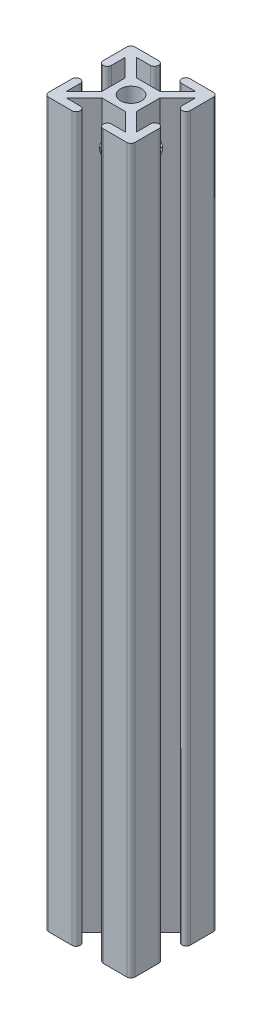
from build123d import *

# Parameters (mm, degrees)
CROQUIS1_R              = 3.645
SALIENTE_EXTRUIR1_DEPTH = 200
CROQUIS1_2_R            = 3.645
SALIENTE_EXTRUIR2_DEPTH = 250
SKETCH1_R               = 6.5
CUT_EXTRUDE1_DEPTH      = 12
SKETCH2_R               = 6.494213274
CUT_EXTRUDE2_DEPTH      = 12
SKETCH3_R               = 4
CUT_EXTRUDE3_DEPTH      = 12
SKETCH4_R               = 4
CUT_EXTRUDE4_DEPTH      = 12


with BuildPart() as part:
    # Croquis1 → Saliente-Extruir1 (new body)
    with BuildSketch(Plane(origin=(0, 0, 0), x_dir=(1, 0, 0), z_dir=(0, 1, 0))):
        with BuildLine():
            Line((32.848419758, -5.213604898), (37.573419758, -5.213604898))
            Line((37.573419758, -5.213604898), (31.423419758, 0.936395102))
            Line((31.423419758, 0.936395102), (23.423419758, 0.936395102))
            Line((23.423419758, 0.936395102), (17.273419758, -5.213604898))
            Line((17.273419758, -5.213604898), (21.998419758, -5.213604898))
            ThreePointArc((21.998419758, -5.213604898), (23.423419758, -6.638604898), (21.998419758, -8.063604898))
            Line((21.998419758, -8.063604898), (13.821983985, -8.037169125))
            ThreePointArc((13.821983985, -8.037169125), (12.833049736, -7.627539147), (12.423419758, -6.638604898))
            Line((12.423419758, -6.638604898), (12.423419758, 1.511395102))
            ThreePointArc((12.423419758, 1.511395102), (13.821983985, 2.90995933), (15.220548212, 1.511395102))
            Line((15.220548212, 1.511395102), (15.220548212, -3.213604898))
            Line((15.220548212, -3.213604898), (21.370548212, 2.936395102))
            Line((21.370548212, 2.936395102), (21.370548212, 10.936395102))
            Line((21.370548212, 10.936395102), (15.220548212, 17.086395102))
            Line((15.220548212, 17.086395102), (15.220548212, 12.361395102))
            ThreePointArc((15.220548212, 12.361395102), (13.795548212, 10.936395102), (12.370548212, 12.361395102))
            Line((12.370548212, 12.361395102), (12.370548212, 20.511348512))
            ThreePointArc((12.370548212, 20.511348512), (12.787921049, 21.518975675), (13.795548212, 21.936348512))
            Line((13.795548212, 21.936348512), (21.945548212, 21.936348512))
            ThreePointArc((21.945548212, 21.936348512), (23.370548212, 20.511348512), (21.945548212, 19.086348512))
            Line((21.945548212, 19.086348512), (17.220548212, 19.086348512))
            Line((17.220548212, 19.086348512), (23.370548212, 12.936348512))
            Line((23.370548212, 12.936348512), (31.370548212, 12.936348512))
            Line((31.370548212, 12.936348512), (37.520548212, 19.086348512))
            Line((37.520548212, 19.086348512), (32.795548212, 19.086348512))
            ThreePointArc((32.795548212, 19.086348512), (31.370548212, 20.511348512), (32.795548212, 21.936348512))
            Line((32.795548212, 21.936348512), (40.945548212, 21.936348512))
            ThreePointArc((40.945548212, 21.936348512), (41.953175376, 21.518975675), (42.370548212, 20.511348512))
            Line((42.370548212, 20.511348512), (42.370548212, 12.465092198))
            ThreePointArc((42.370548212, 12.465092198), (40.945548212, 11.040092198), (39.520548212, 12.465092198))
            Line((39.520548212, 12.465092198), (39.520548212, 17.086348512))
            Line((39.520548212, 17.086348512), (33.370548212, 10.936348512))
            Line((33.370548212, 10.936348512), (33.370548212, 2.936348512))
            Line((33.370548212, 2.936348512), (39.520548212, -3.213651488))
            Line((39.520548212, -3.213651488), (39.520548212, 1.615092198))
            ThreePointArc((39.520548212, 1.615092198), (40.945548212, 3.040092198), (42.370548212, 1.615092198))
            Line((42.370548212, 1.615092198), (42.370548212, -6.638604898))
            ThreePointArc((42.370548212, -6.638604898), (41.953175376, -7.646232061), (40.945548212, -8.063604898))
            Line((40.945548212, -8.063604898), (32.848419758, -8.063604898))
            ThreePointArc((32.848419758, -8.063604898), (31.423419758, -6.638604898), (32.848419758, -5.213604898))
        make_face()
        with Locations((27.423419758, 6.936395102)):
            Circle(CROQUIS1_R, mode=Mode.SUBTRACT)
    extrude(amount=SALIENTE_EXTRUIR1_DEPTH)

    # Croquis1<2> → Saliente-Extruir2 (add)
    with BuildSketch(Plane(origin=(0, 0, 0), x_dir=(1, 0, 0), z_dir=(0, 1, 0))):
        with BuildLine():
            Line((32.848419758, -5.213604898), (37.573419758, -5.213604898))
            Line((37.573419758, -5.213604898), (31.423419758, 0.936395102))
            Line((31.423419758, 0.936395102), (23.423419758, 0.936395102))
            Line((23.423419758, 0.936395102), (17.273419758, -5.213604898))
            Line((17.273419758, -5.213604898), (21.998419758, -5.213604898))
            ThreePointArc((21.998419758, -5.213604898), (23.423419758, -6.638604898), (21.998419758, -8.063604898))
            Line((21.998419758, -8.063604898), (13.821983985, -8.037169125))
            ThreePointArc((13.821983985, -8.037169125), (12.833049736, -7.627539147), (12.423419758, -6.638604898))
            Line((12.423419758, -6.638604898), (12.423419758, 1.511395102))
            ThreePointArc((12.423419758, 1.511395102), (13.821983985, 2.90995933), (15.220548212, 1.511395102))
            Line((15.220548212, 1.511395102), (15.220548212, -3.213604898))
            Line((15.220548212, -3.213604898), (21.370548212, 2.936395102))
            Line((21.370548212, 2.936395102), (21.370548212, 10.936395102))
            Line((21.370548212, 10.936395102), (15.220548212, 17.086395102))
            Line((15.220548212, 17.086395102), (15.220548212, 12.361395102))
            ThreePointArc((15.220548212, 12.361395102), (13.795548212, 10.936395102), (12.370548212, 12.361395102))
            Line((12.370548212, 12.361395102), (12.370548212, 20.511348512))
            ThreePointArc((12.370548212, 20.511348512), (12.787921049, 21.518975675), (13.795548212, 21.936348512))
            Line((13.795548212, 21.936348512), (21.945548212, 21.936348512))
            ThreePointArc((21.945548212, 21.936348512), (23.370548212, 20.511348512), (21.945548212, 19.086348512))
            Line((21.945548212, 19.086348512), (17.220548212, 19.086348512))
            Line((17.220548212, 19.086348512), (23.370548212, 12.936348512))
            Line((23.370548212, 12.936348512), (31.370548212, 12.936348512))
            Line((31.370548212, 12.936348512), (37.520548212, 19.086348512))
            Line((37.520548212, 19.086348512), (32.795548212, 19.086348512))
            ThreePointArc((32.795548212, 19.086348512), (31.370548212, 20.511348512), (32.795548212, 21.936348512))
            Line((32.795548212, 21.936348512), (40.945548212, 21.936348512))
            ThreePointArc((40.945548212, 21.936348512), (41.953175376, 21.518975675), (42.370548212, 20.511348512))
            Line((42.370548212, 20.511348512), (42.370548212, 12.465092198))
            ThreePointArc((42.370548212, 12.465092198), (40.945548212, 11.040092198), (39.520548212, 12.465092198))
            Line((39.520548212, 12.465092198), (39.520548212, 17.086348512))
            Line((39.520548212, 17.086348512), (33.370548212, 10.936348512))
            Line((33.370548212, 10.936348512), (33.370548212, 2.936348512))
            Line((33.370548212, 2.936348512), (39.520548212, -3.213651488))
            Line((39.520548212, -3.213651488), (39.520548212, 1.615092198))
            ThreePointArc((39.520548212, 1.615092198), (40.945548212, 3.040092198), (42.370548212, 1.615092198))
            Line((42.370548212, 1.615092198), (42.370548212, -6.638604898))
            ThreePointArc((42.370548212, -6.638604898), (41.953175376, -7.646232061), (40.945548212, -8.063604898))
            Line((40.945548212, -8.063604898), (32.848419758, -8.063604898))
            ThreePointArc((32.848419758, -8.063604898), (31.423419758, -6.638604898), (32.848419758, -5.213604898))
        make_face()
        with Locations((27.423419758, 6.936395102)):
            Circle(CROQUIS1_2_R, mode=Mode.SUBTRACT)
    extrude(amount=SALIENTE_EXTRUIR2_DEPTH)

    # Sketch1 → Cut-Extrude1 (cut)
    with BuildSketch(Plane(origin=(0, 0, -12.936348512), x_dir=(-1, 0, 0), z_dir=(0, 0, -1))):
        with Locations((-27.335316088, 235)):
            Circle(SKETCH1_R)
    extrude(amount=-CUT_EXTRUDE1_DEPTH, mode=Mode.SUBTRACT)

    # Sketch2 → Cut-Extrude2 (cut)
    with BuildSketch(Plane(origin=(33.370548212, 0, 0), x_dir=(0, 0, -1), z_dir=(1, 0, 0))):
        with Locations((6.999984182, 235)):
            Circle(SKETCH2_R)
    extrude(amount=-CUT_EXTRUDE2_DEPTH, mode=Mode.SUBTRACT)

    # Sketch3 → Cut-Extrude3 (cut)
    with BuildSketch(Plane(origin=(0, 0, -12.936348512), x_dir=(-1, 0, 0), z_dir=(0, 0, -1))):
        with Locations((-27.423419758, 55.00004659)):
            Circle(SKETCH3_R)
    extrude(amount=-CUT_EXTRUDE3_DEPTH, mode=Mode.SUBTRACT)

    # Sketch4 → Cut-Extrude4 (cut)
    with BuildSketch(Plane.ZY.offset(-21.370548212)):
        with Locations((-6.989220058, 55.00004659)):
            Circle(SKETCH4_R)
    extrude(amount=-CUT_EXTRUDE4_DEPTH, mode=Mode.SUBTRACT)


solid = part.part
